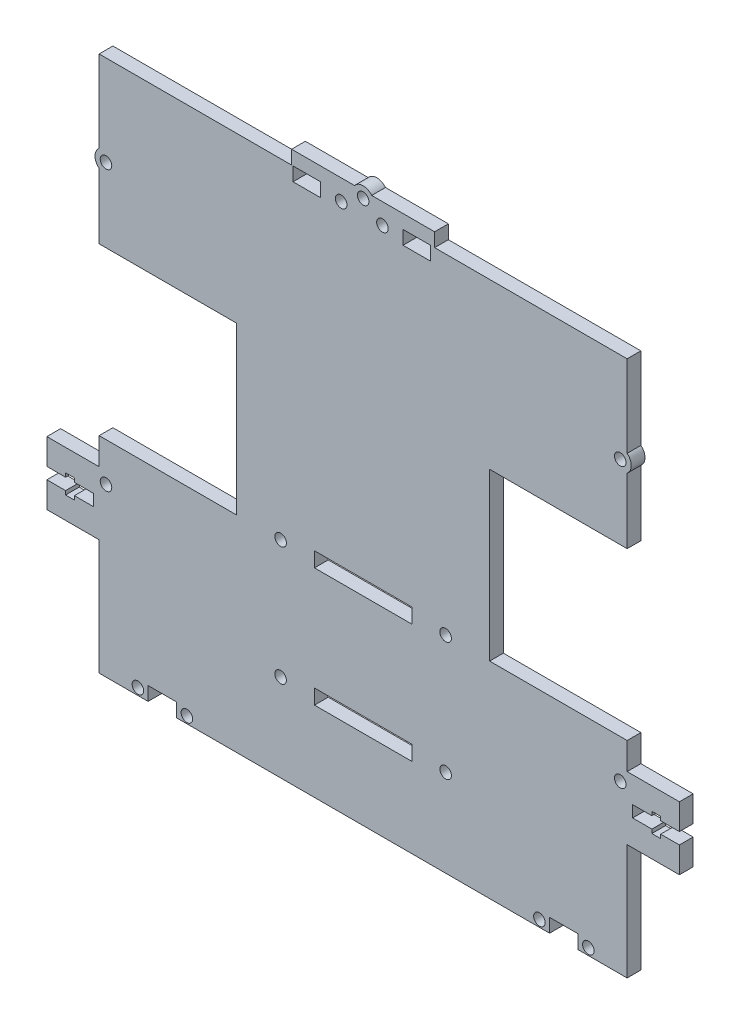
from build123d import *

# Parameters (mm, degrees)
SKETCH1_R           = 2.1
BOSS_EXTRUDE1_DEPTH = 5
SKETCH5_W           = 35
SKETCH5_H           = 5
SKETCH5_W_2         = 10
CUT_EXTRUDE2_DEPTH  = 5
SKETCH6_R           = 2.1
CUT_EXTRUDE3_DEPTH  = 5
SKETCH8_R           = 2.1
SKETCH8_W           = 10
SKETCH8_H           = 5
CUT_EXTRUDE4_DEPTH  = 5
BOSS_EXTRUDE3_START = -5
BOSS_EXTRUDE3_DEPTH = 5
SKETCH12_W          = 10.4
SKETCH12_H          = 5
CUT_EXTRUDE5_DEPTH  = 5
SKETCH13_W          = 35.4
SKETCH13_H          = 5.4
CUT_EXTRUDE6_DEPTH  = 5
SKETCH16_W          = 50
SKETCH16_H          = 60.4
CUT_EXTRUDE8_DEPTH  = 5
SKETCH17_W          = 6.8
SKETCH17_H          = 4.2
SKETCH17_W_2        = 3.2
SKETCH17_H_2        = 1.4
SKETCH17_W_3        = 7
CUT_EXTRUDE9_DEPTH  = 5


with BuildPart() as part:
    # Sketch1 → Boss-Extrude1 (new body)
    with BuildSketch(Plane.XY):
        with BuildLine():
            ThreePointArc((0, -29.777501001), (-1.5, -32.9), (0, -36.022498999))
            Line((0, -36.022498999), (0, -60))
            Line((0, -60), (50, -60))
            Line((50, -60), (50, -120))
            Line((50, -120), (0, -120))
            Line((0, -120), (0, -131.177501001))
            ThreePointArc((0, -131.177501001), (-1.5, -134.3), (0, -137.422498999))
            Line((0, -137.422498999), (0, -195))
            Line((0, -195), (192, -195))
            Line((192, -195), (192, -137.422498999))
            ThreePointArc((192, -137.422498999), (193.5, -134.3), (192, -131.177501001))
            Line((192, -131.177501001), (192, -120))
            Line((192, -120), (142, -120))
            Line((142, -120), (142, -60))
            Line((142, -60), (192, -60))
            Line((192, -60), (192, -36.022498999))
            ThreePointArc((192, -36.022498999), (193.5, -32.9), (192, -29.777501001))
            Line((192, -29.777501001), (192, 0))
            Line((192, 0), (122, 0))
            Line((122, 0), (122, 5))
            Line((122, 5), (99.122498999, 5))
            ThreePointArc((99.122498999, 5), (96, 6.5), (92.877501001, 5))
            Line((92.877501001, 5), (70, 5))
            Line((70, 5), (70, 0))
            Line((70, 0), (59, 0))
            Line((59, 0), (0, 0))
            Line((0, 0), (0, -21))
            Line((0, -21), (0, -29.777501001))
        make_face()
        with Locations((2.5, -134.3)):
            Circle(SKETCH1_R, mode=Mode.SUBTRACT)
        with Locations((189.5, -134.3)):
            Circle(SKETCH1_R, mode=Mode.SUBTRACT)
        with Locations((2.5, -32.9)):
            Circle(SKETCH1_R, mode=Mode.SUBTRACT)
        with Locations((96, 2.5)):
            Circle(SKETCH1_R, mode=Mode.SUBTRACT)
        with Locations((189.5, -32.9)):
            Circle(SKETCH1_R, mode=Mode.SUBTRACT)
    extrude(amount=BOSS_EXTRUDE1_DEPTH)

    # Sketch5 → Cut-Extrude2 (cut)
    with BuildSketch(Plane.XY.offset(5)):
        with Locations((96, -163.217967697)):
            Rectangle(SKETCH5_W, SKETCH5_H)
        with Locations((96, -120)):
            Rectangle(SKETCH5_W, SKETCH5_H)
        with Locations((23, -192.5)):
            Rectangle(SKETCH5_W_2, SKETCH5_H)
        with Locations((169, -192.5)):
            Rectangle(SKETCH5_W_2, SKETCH5_H)
    extrude(amount=-CUT_EXTRUDE2_DEPTH, mode=Mode.SUBTRACT)

    # Sketch6 → Cut-Extrude3 (cut)
    with BuildSketch(Plane.XY.offset(5)):
        with Locations((213.012247999, -33.340051313)):
            Circle(SKETCH6_R)
        with Locations((177.9, -192.5)):
            Circle(SKETCH6_R)
        with Locations(Location((160.1, -192.5, 0), (0, 0, 180))):
            Circle(SKETCH6_R)
        with Locations((-21.012247999, -33.340051313)):
            Circle(SKETCH6_R)
        with Locations((31.9, -192.5)):
            Circle(SKETCH6_R)
        with Locations(Location((14.1, -192.5, 0), (0, 0, 180))):
            Circle(SKETCH6_R)
        with Locations((126, -120)):
            Circle(SKETCH6_R)
        with Locations((126, -163.217967697)):
            Circle(SKETCH6_R)
        with Locations(Location((66, -163.217967697, 0), (0, 0, 180))):
            Circle(SKETCH6_R)
        with Locations(Location((66, -120, 0), (0, 0, 180))):
            Circle(SKETCH6_R)
    extrude(amount=-CUT_EXTRUDE3_DEPTH, mode=Mode.SUBTRACT)

    # Sketch8 → Cut-Extrude4 (cut)
    with BuildSketch(Plane.XY.offset(5)):
        with Locations((88.012247999, -2.5)):
            Circle(SKETCH8_R)
        with Locations((103.012247999, -2.5)):
            Circle(SKETCH8_R)
        with Locations((75.512247999, -2.5)):
            Rectangle(SKETCH8_W, SKETCH8_H)
        with Locations((115.512247999, -2.5)):
            Rectangle(SKETCH8_W, SKETCH8_H)
    extrude(amount=-CUT_EXTRUDE4_DEPTH, mode=Mode.SUBTRACT)

    # Sketch9 → Boss-Extrude3 (add)
    with BuildSketch(Plane.XY.offset(5).offset(BOSS_EXTRUDE3_START)):
        with BuildLine():
            Line((-19, -130), (0, -130))
            Line((0, -130), (0, -131.177501001))
            ThreePointArc((0, -131.177501001), (-1.5, -134.3), (0, -137.422498999))
            Line((0, -137.422498999), (0, -153))
            Line((0, -153), (-19, -153))
            Line((-19, -153), (-19, -130))
        make_face()
    boss_extrude3 = extrude(amount=BOSS_EXTRUDE3_DEPTH)

    # Sketch12 → Cut-Extrude5 (cut)
    with BuildSketch(Plane.XY.offset(5)):
        with Locations((23, -192.5)):
            Rectangle(SKETCH12_W, SKETCH12_H)
        with Locations((169, -192.5)):
            Rectangle(SKETCH12_W, SKETCH12_H)
    extrude(amount=-CUT_EXTRUDE5_DEPTH, mode=Mode.SUBTRACT)

    # Sketch13 → Cut-Extrude6 (cut)
    with BuildSketch(Plane.XY.offset(5)):
        with Locations((96, -120)):
            Rectangle(SKETCH13_W, SKETCH13_H)
        with Locations((96, -163.217967697)):
            Rectangle(SKETCH13_W, SKETCH13_H)
    extrude(amount=-CUT_EXTRUDE6_DEPTH, mode=Mode.SUBTRACT)

    # Sketch16 → Cut-Extrude8 (cut)
    with BuildSketch(Plane.XY.offset(5)):
        with Locations((25, -90)):
            Rectangle(SKETCH16_W, SKETCH16_H)
        with Locations((167, -90)):
            Rectangle(SKETCH16_W, SKETCH16_H)
    extrude(amount=-CUT_EXTRUDE8_DEPTH, mode=Mode.SUBTRACT)

    # Mirror2: Boss-Extrude3 across plane
    add(boss_extrude3.mirror(Plane(origin=(96, 0, 0), x_dir=(0, 0, 1), z_dir=(1, 0, 0))))

    # Sketch17 → Cut-Extrude9 (cut)
    with BuildSketch(Plane.XY.offset(5)):
        with Locations((207.6, -141.5)):
            Rectangle(SKETCH17_W, SKETCH17_H)
        with Locations((202.6, -141.5)):
            Rectangle(SKETCH17_W_2, SKETCH17_H)
        with Locations((202.6, -138.7)):
            Rectangle(SKETCH17_W_2, SKETCH17_H_2)
        with Locations((197.5, -141.5)):
            Rectangle(SKETCH17_W_3, SKETCH17_H)
        with Locations((202.6, -144.3)):
            Rectangle(SKETCH17_W_2, SKETCH17_H_2)
        with Locations((-15.6, -141.5)):
            Rectangle(SKETCH17_W, SKETCH17_H)
        with Locations((-10.6, -138.7)):
            Rectangle(SKETCH17_W_2, SKETCH17_H_2)
        with Locations((-10.6, -141.5)):
            Rectangle(SKETCH17_W_2, SKETCH17_H)
        with Locations((-5.5, -141.5)):
            Rectangle(SKETCH17_W_3, SKETCH17_H)
        with Locations((-10.6, -144.3)):
            Rectangle(SKETCH17_W_2, SKETCH17_H_2)
    extrude(amount=-CUT_EXTRUDE9_DEPTH, mode=Mode.SUBTRACT)


solid = part.part
